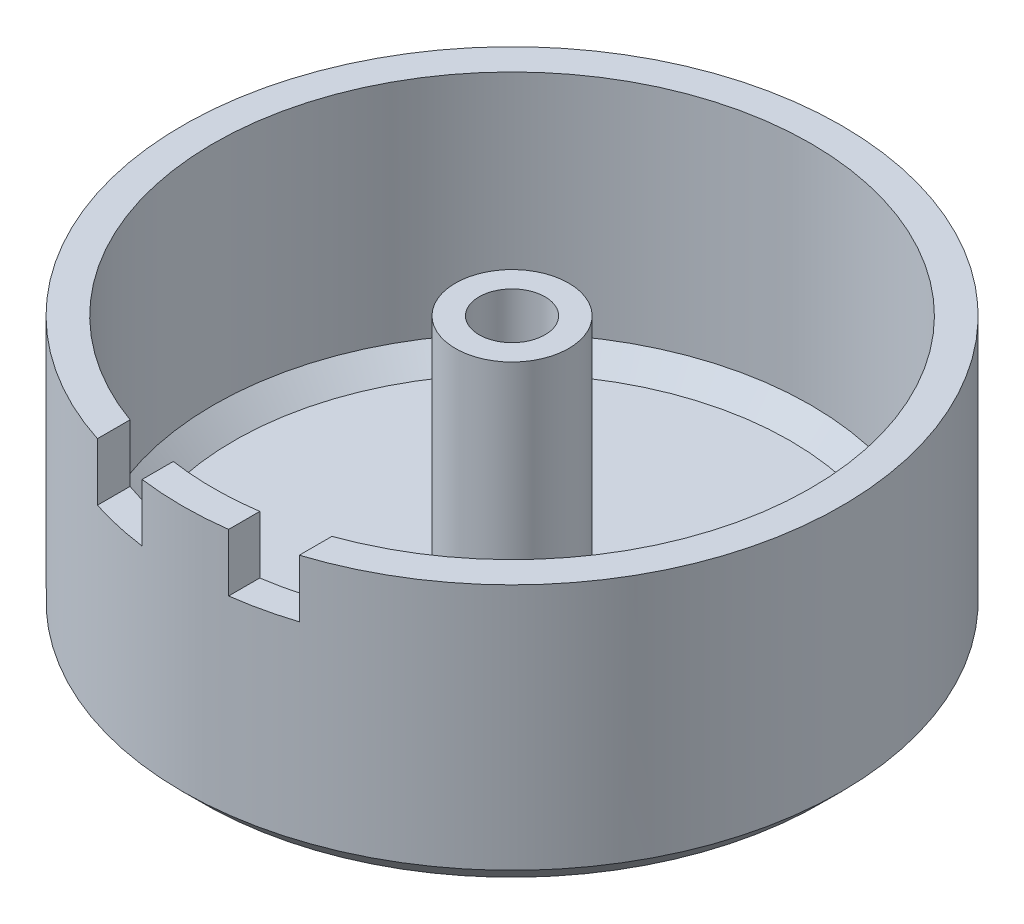
from build123d import *

# Parameters (mm, degrees)
CUT_EXTRUDE1_START = 10
SKETCH2_W          = 2.8
SKETCH2_H          = 2.8
CUT_EXTRUDE1_DEPTH = 10


with BuildPart() as part:
    # Sketch1 → Revolve1 (revolve)
    with BuildSketch(Plane.XY, mode=Mode.PRIVATE) as revolve1_sk:
        Polygon((-14.5, 6.25), (-14.5, -4.75), (-13.5, -5.75), (-2.75, -5.75), (-2.75, 6.25), (-1.6, 6.25), (-1.6, -6.75), (-15.002979439, -6.75), (-16, -5.752979439), (-16, 6.25), align=None)
    revolve(revolve1_sk.sketch.rotate(Axis((0, 0, 0), (0, 1, 0)), 270), axis=Axis((0, 0, 0), (0, 1, 0)))

    # Sketch2 → Cut-Extrude1 (cut)
    with BuildSketch(Plane.XY.offset(CUT_EXTRUDE1_START)):
        with Locations((-3.5, 4.85)):
            Rectangle(SKETCH2_W, SKETCH2_H)
        with Locations((3.5, 4.85)):
            Rectangle(SKETCH2_W, SKETCH2_H)
    extrude(amount=CUT_EXTRUDE1_DEPTH, mode=Mode.SUBTRACT)


solid = part.part
